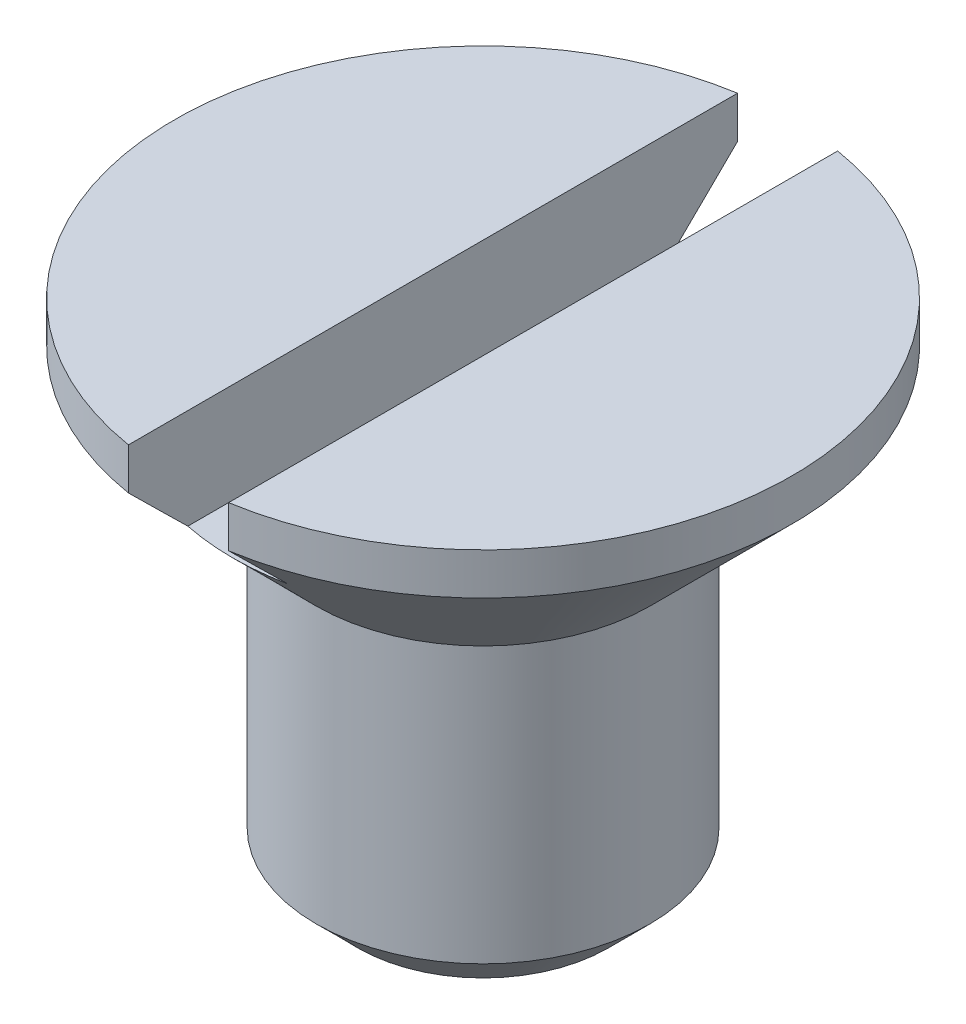
from build123d import *

# Parameters (mm, degrees)
CUT_EXTRUDE_1_DEPTH      = 8.961155695
CUT_EXTRUDE_1_DEPTH_BACK = 8.961155695
SKETCH_2_W               = 1.2
SKETCH_2_H               = 1.2


with BuildPart() as part:
    # Эскиз1 → Повернуть1 (revolve)
    with BuildSketch(Plane.XY):
        Polygon((0, 0), (-1.5, 0), (-2, 0.5), (-2, 3.8), (-3.7, 5.5), (-3.7, 6), (0, 6), align=None)
    revolve(axis=Axis((0, 6, 0), (0, -1, 0)))

    # Эскиз2 → Вырез-Вытянуть1 (cut, two sides: drawn at the far end of the back side and taken through both)
    with BuildSketch(Plane.XY.offset(-CUT_EXTRUDE_1_DEPTH_BACK)):
        with Locations((0, 5.4)):
            Rectangle(SKETCH_2_W, SKETCH_2_H)
    extrude(amount=CUT_EXTRUDE_1_DEPTH + CUT_EXTRUDE_1_DEPTH_BACK, mode=Mode.SUBTRACT)


solid = part.part
